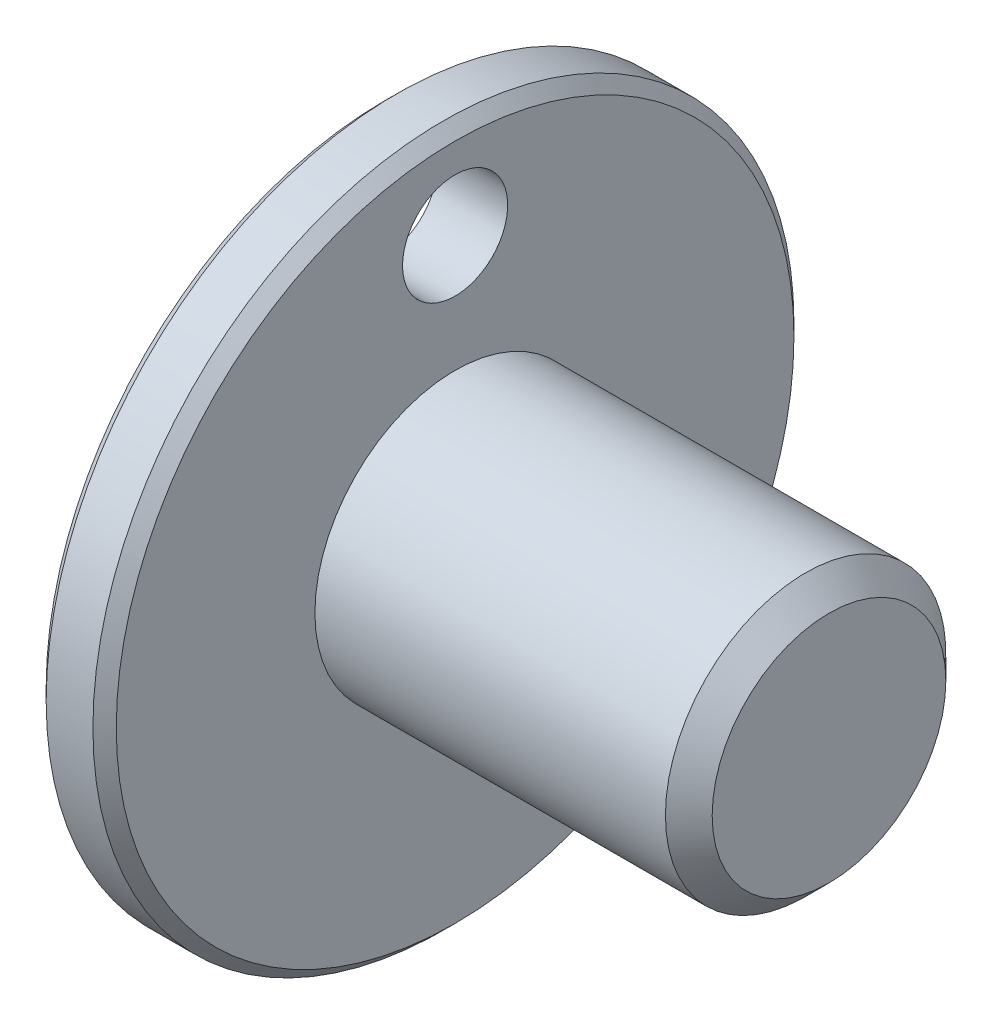
from build123d import *

# Parameters (mm, degrees)
CHANFREIN1_SIZE         = 1
CHANFREIN2_SIZE         = 0.5
ESQUISSE2_R             = 2.25
ENL_V_MAT_EXTRU_1_DEPTH = 29.478061732


with BuildPart() as part:
    # Esquisse1 → Base-Révolution (revolve)
    with BuildSketch(Plane.XY, mode=Mode.PRIVATE) as base_r_volution_sk:
        Polygon((-3, 0), (-3, 15), (0, 15), (0, 6), (16, 6), (16, 0), align=None)
    revolve(base_r_volution_sk.sketch.rotate(Axis((-27.336707152, 0, 0), (1, 0, 0)), 90), axis=Axis((-27.336707152, 0, 0), (1, 0, 0)))

    # Chanfrein1
    chanfrein1_edges = [part.edges().sort_by_distance(p)[0] for p in [
        (16, 0, -6),
    ]]
    chamfer(chanfrein1_edges, length=CHANFREIN1_SIZE)

    # Chanfrein2
    chanfrein2_edges = [part.edges().sort_by_distance(p)[0] for p in [
        (-3, 0, -15),
        (0, 0, -15),
    ]]
    chamfer(chanfrein2_edges, length=CHANFREIN2_SIZE)

    # Esquisse2 → Enlèv. mat.-Extru.1 (cut, through all)
    with BuildSketch(Plane.ZY.offset(3)):
        with Locations((0, 11)):
            Circle(ESQUISSE2_R)
    extrude(amount=-ENL_V_MAT_EXTRU_1_DEPTH, mode=Mode.SUBTRACT)


solid = part.part
